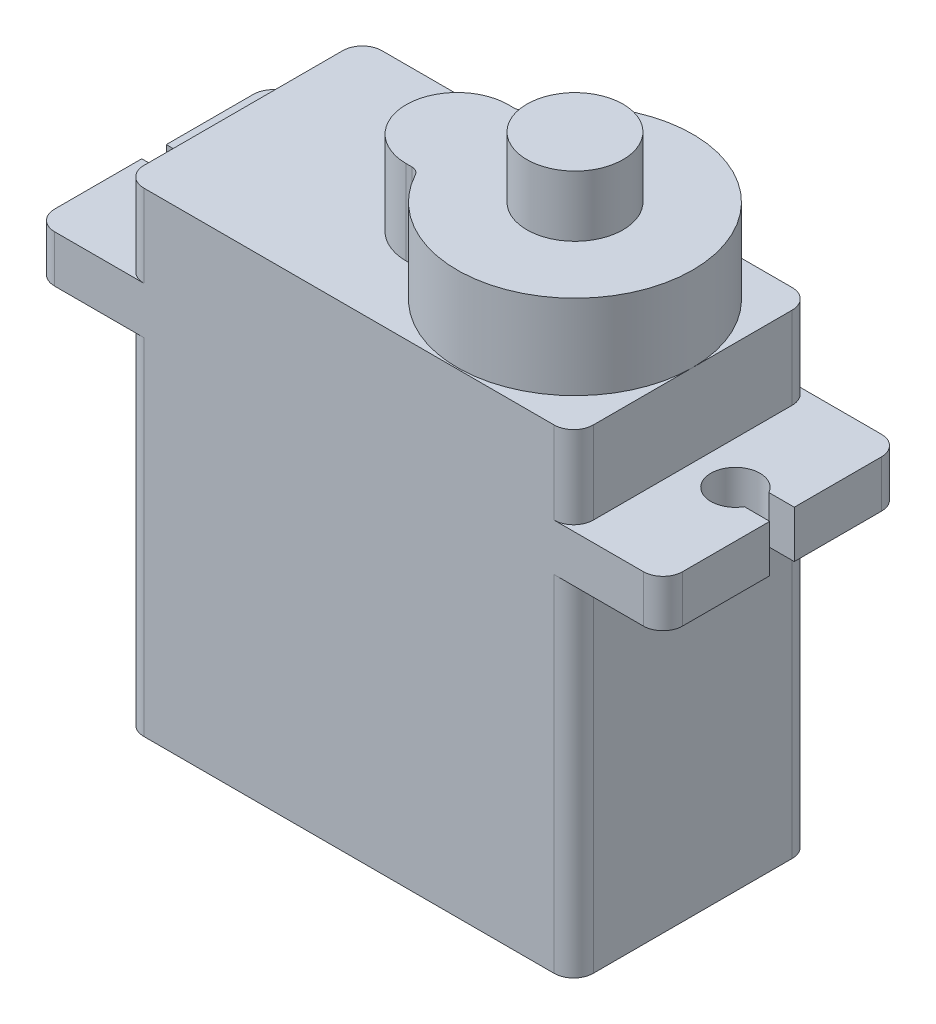
from build123d import *

# Parameters (mm, degrees)
ESBO_O2_W                  = 22.9
ESBO_O2_H                  = 12.13
RESSALTO_EXTRUS_O1_DEPTH   = 17.35
ESBO_O3_W                  = 32
ESBO_O3_H                  = 12.13
RESSALTO_EXTRUS_O2_DEPTH   = 2.4
ESBO_O4_W                  = 22.9
ESBO_O4_H                  = 12.13
RESSALTO_EXTRUS_O3_DEPTH   = 4.45
CORTE_EXTRUS_O1_DEPTH      = 2.4
RESSALTO_EXTRUS_O4_DEPTH   = 4.3
ESBO_O7_R                  = 2.45
RESSALTO_EXTRUS_O5_DEPTH   = 3.1
CORTE_EXTRUS_O2_DEPTH      = 1
CORTE_EXTRUS_O2_DEPTH_BACK = 16
ESBO_O10_W                 = 9.190370446
ESBO_O10_H                 = 13.482765879
ESBO_O10_W_2               = 7.294178248
ESBO_O10_H_2               = 14.557386271
RESSALTO_EXTRUS_O7_DEPTH   = 2.4
FILETE1_R                  = 1


with BuildPart() as part:
    # Esboço2 → Ressalto-extrusão1 (new body)
    with BuildSketch(Plane(origin=(0, 0, 0), x_dir=(1, 0, 0), z_dir=(0, 1, 0))):
        Rectangle(ESBO_O2_W, ESBO_O2_H)
    extrude(amount=RESSALTO_EXTRUS_O1_DEPTH)

    # Esboço3 → Ressalto-extrusão2 (add)
    with BuildSketch(Plane(origin=(0, 17.35, 0), x_dir=(1, 0, 0), z_dir=(0, 1, 0))):
        Rectangle(ESBO_O3_W, ESBO_O3_H)
    extrude(amount=RESSALTO_EXTRUS_O2_DEPTH)

    # Esboço4 → Ressalto-extrusão3 (add)
    with BuildSketch(Plane(origin=(0, 19.75, 0), x_dir=(1, 0, 0), z_dir=(0, 1, 0))):
        Rectangle(ESBO_O4_W, ESBO_O4_H)
    extrude(amount=RESSALTO_EXTRUS_O3_DEPTH)

    # Esboço5 → Corte-extrusão1 (cut)
    with BuildSketch(Plane(origin=(0, 19.75, 0), x_dir=(1, 0, 0), z_dir=(0, 1, 0))):
        with BuildLine():
            Line((-16, -0.625), (-16, 0.625))
            Line((-16, 0.625), (-14.707531755, 0.625))
            ThreePointArc((-14.707531755, 0.625), (-12.375, 0), (-14.707531755, -0.625))
            Line((-14.707531755, -0.625), (-16, -0.625))
        make_face()
        with BuildLine():
            Line((14.707531755, -0.625), (16, -0.625))
            Line((16, -0.625), (16, 0.625))
            Line((16, 0.625), (14.707531755, 0.625))
            ThreePointArc((14.707531755, 0.625), (12.375, 0), (14.707531755, -0.625))
        make_face()
    extrude(amount=-CORTE_EXTRUS_O1_DEPTH, mode=Mode.SUBTRACT)

    # Esboço6 → Ressalto-extrusão4 (add)
    with BuildSketch(Plane(origin=(0, 24.2, 0), x_dir=(1, 0, 0), z_dir=(0, 1, 0))):
        with BuildLine():
            Line((-0.55, -2.6), (-0.263142743, -2.6))
            ThreePointArc((-0.263142743, -2.6), (-0.007438587, -2.670331076), (0.176329776, -2.861538462))
            ThreePointArc((0.176329776, -2.861538462), (11.45, 0), (0.176329776, 2.861538462))
            ThreePointArc((0.176329776, 2.861538462), (-0.007438587, 2.670331076), (-0.263142743, 2.6))
            Line((-0.263142743, 2.6), (-0.55, 2.6))
            ThreePointArc((-0.55, 2.6), (-3.15, 0), (-0.55, -2.6))
        make_face()
    extrude(amount=RESSALTO_EXTRUS_O4_DEPTH)

    # Esboço7 → Ressalto-extrusão5 (add)
    with BuildSketch(Plane(origin=(0, 28.5, 0), x_dir=(1, 0, 0), z_dir=(0, 1, 0))):
        with Locations(Location((5.45, 0, 0), (0, 0, 90))):
            Circle(ESBO_O7_R)
    extrude(amount=RESSALTO_EXTRUS_O5_DEPTH)

    # Esboço10 → Corte-extrusão2 (cut, two sides: drawn at the far end of the back side and taken through both)
    with BuildSketch(Plane(origin=(0, 28.5, 0), x_dir=(1, 0, 0), z_dir=(0, 1, 0)).offset(-CORTE_EXTRUS_O2_DEPTH_BACK)):
        with Locations((16.045185223, -0.676382939)):
            Rectangle(ESBO_O10_W, ESBO_O10_H)
        with Locations((-15.097089124, -1.213693136)):
            Rectangle(ESBO_O10_W_2, ESBO_O10_H_2)
    extrude(amount=CORTE_EXTRUS_O2_DEPTH + CORTE_EXTRUS_O2_DEPTH_BACK, mode=Mode.SUBTRACT)

    # Esboço12 → Ressalto-extrusão7 (add)
    with BuildSketch(Plane(origin=(0, 17.6, 0), x_dir=(1, 0, 0), z_dir=(0, 1, 0))):
        with BuildLine():
            Line((16, 0.625), (14.707531755, 0.625))
            ThreePointArc((14.707531755, 0.625), (12.375, 0), (14.707531755, -0.625))
            Line((14.707531755, -0.625), (16, -0.625))
            Line((16, -0.625), (16, -6.065))
            Line((16, -6.065), (11.45, -6.065))
            Line((11.45, -6.065), (11.45, 6.065))
            Line((11.45, 6.065), (16, 6.065))
            Line((16, 6.065), (16, 0.625))
        make_face()
        with BuildLine():
            Line((-16, -0.625), (-16, -6.065))
            Line((-16, -6.065), (-11.45, -6.065))
            Line((-11.45, -6.065), (-11.45, 6.065))
            Line((-11.45, 6.065), (-16, 6.065))
            Line((-16, 6.065), (-16, 0.625))
            Line((-16, 0.625), (-14.707531755, 0.625))
            ThreePointArc((-14.707531755, 0.625), (-12.375, 0), (-14.707531755, -0.625))
            Line((-14.707531755, -0.625), (-16, -0.625))
        make_face()
    extrude(amount=RESSALTO_EXTRUS_O7_DEPTH)

    # Filete1
    filete1_edges = [part.edges().sort_by_distance(p)[0] for p in [
        (11.45, 8.8, 6.065),
        (11.45, 8.8, -6.065),
        (16, 18.8, -6.065),
        (16, 18.8, 6.065),
        (-11.45, 8.8, 6.065),
        (-11.45, 8.8, -6.065),
        (-16, 18.8, 6.065),
        (-16, 18.8, -6.065),
        (-11.45, 22.1, -6.065),
        (11.45, 22.1, -6.065),
        (11.45, 22.1, 6.065),
        (-11.45, 22.1, 6.065),
    ]]
    fillet(filete1_edges, radius=FILETE1_R)


solid = part.part
